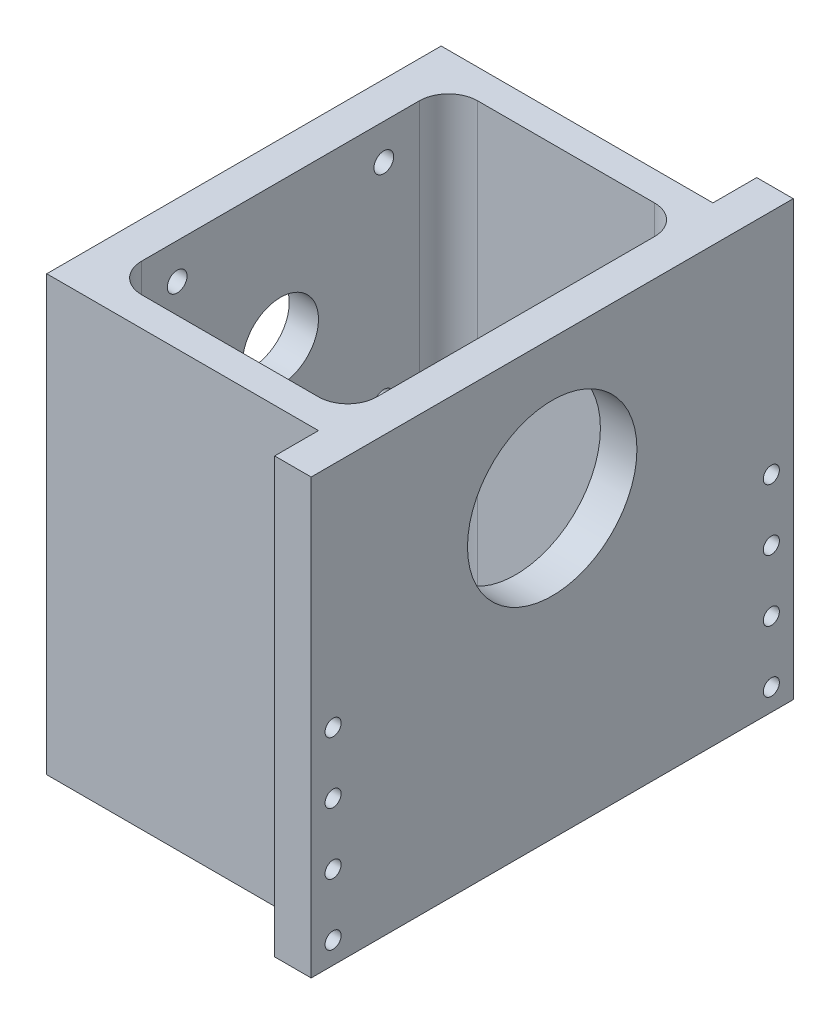
from build123d import *

# Parameters (mm, degrees)
EXTRUDE_1_DEPTH          = 297
SKETCH_6_R               = 57.15
CUT_EXTRUDE_1_DEPTH      = 5
CUT_EXTRUDE_2_REACH      = 528.789
SKETCH_7_R               = 26
CUT_EXTRUDE_3_REACH      = 530.764
SKETCH_8_R               = 58
CUT_EXTRUDE_4_REACH      = 521.294
SKETCH_10_R              = 5.5
HOLE_WIZARD_M12_1_D      = 13.5
HOLE_WIZARD_M12_1_DEPTH  = 25
PATTERN_CIRCULAR_1_COUNT = 4


with BuildPart() as part:
    # 草图4 → 凸台-拉伸1 (new body)
    with BuildSketch(Plane(origin=(0, 0, 0), x_dir=(1, 0, 0), z_dir=(0, 1, 0))):
        Polygon((-258.320541352, -83.224920734), (-258.320541352, -53.224920734), (-233.320541352, -53.224920734), (-233.320541352, -383.224920734), (-258.320541352, -383.224920734), (-258.320541352, -353.224920734), (-444.320541352, -353.224920734), (-444.320541352, -83.224920734), align=None)
        with BuildLine():
            Line((-258.320541352, -313.224920734), (-258.320541352, -123.224920734))
            ThreePointArc((-258.320541352, -123.224920734), (-264.178405729, -109.08278511), (-278.320541352, -103.224920734))
            Line((-278.320541352, -103.224920734), (-399.320541352, -103.224920734))
            ThreePointArc((-399.320541352, -103.224920734), (-413.462676976, -109.08278511), (-419.320541352, -123.224920734))
            Line((-419.320541352, -123.224920734), (-419.320541352, -313.224920734))
            ThreePointArc((-419.320541352, -313.224920734), (-413.462676976, -327.367056358), (-399.320541352, -333.224920734))
            Line((-399.320541352, -333.224920734), (-278.320541352, -333.224920734))
            ThreePointArc((-278.320541352, -333.224920734), (-264.178405729, -327.367056358), (-258.320541352, -313.224920734))
        make_face(mode=Mode.SUBTRACT)
    extrude(amount=EXTRUDE_1_DEPTH)

    # 草图6 → 切除-拉伸1 (cut)
    with BuildSketch(Plane.ZY.offset(444.320541352)):
        with Locations((218.224920734, 202)):
            Circle(SKETCH_6_R)
    extrude(amount=-CUT_EXTRUDE_1_DEPTH, mode=Mode.SUBTRACT)

    # 草图7 → 切除-拉伸2 (cut, up to next)
    with BuildSketch(Plane.ZY.offset(439.320541352), mode=Mode.PRIVATE) as cut_extrude_2_sk1:
        with Locations((218.224920734, 202)):
            Circle(SKETCH_7_R)
    cut_extrude_2_tool1 = extrude(cut_extrude_2_sk1.sketch, amount=-CUT_EXTRUDE_2_REACH, mode=Mode.PRIVATE) & part.part
    add(cut_extrude_2_tool1.solids().sort_by_distance((-439.320541, 202, 218.224921))[0], mode=Mode.SUBTRACT)

    # 草图8 → 切除-拉伸3 (cut, up to next)
    with BuildSketch(Plane(origin=(-233.320541352, 0, 0), x_dir=(0, 0, -1), z_dir=(1, 0, 0)), mode=Mode.PRIVATE) as cut_extrude_3_sk1:
        with Locations((-218.224920734, 202)):
            Circle(SKETCH_8_R)
    cut_extrude_3_tool1 = extrude(cut_extrude_3_sk1.sketch, amount=-CUT_EXTRUDE_3_REACH, mode=Mode.PRIVATE) & part.part
    add(cut_extrude_3_tool1.solids().sort_by_distance((-233.320541, 202, 218.224921))[0], mode=Mode.SUBTRACT)

    # 草图10 → 切除-拉伸4 (cut, up to next)
    with BuildSketch(Plane.ZY.offset(258.320541352), mode=Mode.PRIVATE) as cut_extrude_4_sk1:
        with Locations((368.224920734, 15)):
            Circle(SKETCH_10_R)
    cut_extrude_4_tool1 = extrude(cut_extrude_4_sk1.sketch, amount=-CUT_EXTRUDE_4_REACH, mode=Mode.PRIVATE) & part.part
    # 草图10 → 切除-拉伸4 (cut, up to next)
    with BuildSketch(Plane.ZY.offset(258.320541352), mode=Mode.PRIVATE) as cut_extrude_4_sk2:
        with Locations((368.224920734, 57)):
            Circle(SKETCH_10_R)
    cut_extrude_4_tool2 = extrude(cut_extrude_4_sk2.sketch, amount=-CUT_EXTRUDE_4_REACH, mode=Mode.PRIVATE) & part.part
    # 草图10 → 切除-拉伸4 (cut, up to next)
    with BuildSketch(Plane.ZY.offset(258.320541352), mode=Mode.PRIVATE) as cut_extrude_4_sk3:
        with Locations((368.224920734, 99)):
            Circle(SKETCH_10_R)
    cut_extrude_4_tool3 = extrude(cut_extrude_4_sk3.sketch, amount=-CUT_EXTRUDE_4_REACH, mode=Mode.PRIVATE) & part.part
    # 草图10 → 切除-拉伸4 (cut, up to next)
    with BuildSketch(Plane.ZY.offset(258.320541352), mode=Mode.PRIVATE) as cut_extrude_4_sk4:
        with Locations((368.224920734, 141)):
            Circle(SKETCH_10_R)
    cut_extrude_4_tool4 = extrude(cut_extrude_4_sk4.sketch, amount=-CUT_EXTRUDE_4_REACH, mode=Mode.PRIVATE) & part.part
    # 草图10 → 切除-拉伸4 (cut, up to next)
    with BuildSketch(Plane.ZY.offset(258.320541352), mode=Mode.PRIVATE) as cut_extrude_4_sk5:
        with Locations((68.224920734, 141)):
            Circle(SKETCH_10_R)
    cut_extrude_4_tool5 = extrude(cut_extrude_4_sk5.sketch, amount=-CUT_EXTRUDE_4_REACH, mode=Mode.PRIVATE) & part.part
    # 草图10 → 切除-拉伸4 (cut, up to next)
    with BuildSketch(Plane.ZY.offset(258.320541352), mode=Mode.PRIVATE) as cut_extrude_4_sk6:
        with Locations((68.224920734, 15)):
            Circle(SKETCH_10_R)
    cut_extrude_4_tool6 = extrude(cut_extrude_4_sk6.sketch, amount=-CUT_EXTRUDE_4_REACH, mode=Mode.PRIVATE) & part.part
    # 草图10 → 切除-拉伸4 (cut, up to next)
    with BuildSketch(Plane.ZY.offset(258.320541352), mode=Mode.PRIVATE) as cut_extrude_4_sk7:
        with Locations((68.224920734, 57)):
            Circle(SKETCH_10_R)
    cut_extrude_4_tool7 = extrude(cut_extrude_4_sk7.sketch, amount=-CUT_EXTRUDE_4_REACH, mode=Mode.PRIVATE) & part.part
    # 草图10 → 切除-拉伸4 (cut, up to next)
    with BuildSketch(Plane.ZY.offset(258.320541352), mode=Mode.PRIVATE) as cut_extrude_4_sk8:
        with Locations((68.224920734, 99)):
            Circle(SKETCH_10_R)
    cut_extrude_4_tool8 = extrude(cut_extrude_4_sk8.sketch, amount=-CUT_EXTRUDE_4_REACH, mode=Mode.PRIVATE) & part.part
    add(cut_extrude_4_tool1.solids().sort_by_distance((-258.320541, 15, 368.224921))[0], mode=Mode.SUBTRACT)
    add(cut_extrude_4_tool2.solids().sort_by_distance((-258.320541, 57, 368.224921))[0], mode=Mode.SUBTRACT)
    add(cut_extrude_4_tool3.solids().sort_by_distance((-258.320541, 99, 368.224921))[0], mode=Mode.SUBTRACT)
    add(cut_extrude_4_tool4.solids().sort_by_distance((-258.320541, 141, 368.224921))[0], mode=Mode.SUBTRACT)
    add(cut_extrude_4_tool5.solids().sort_by_distance((-258.320541, 141, 68.224921))[0], mode=Mode.SUBTRACT)
    add(cut_extrude_4_tool6.solids().sort_by_distance((-258.320541, 15, 68.224921))[0], mode=Mode.SUBTRACT)
    add(cut_extrude_4_tool7.solids().sort_by_distance((-258.320541, 57, 68.224921))[0], mode=Mode.SUBTRACT)
    add(cut_extrude_4_tool8.solids().sort_by_distance((-258.320541, 99, 68.224921))[0], mode=Mode.SUBTRACT)

    # M12 间隙孔1
    with Locations(Plane.ZY.offset(444.320541352)):
        with Locations((147.514920734, 272.711356231)):
            hole_wizard_m12_1 = Hole(HOLE_WIZARD_M12_1_D / 2, depth=HOLE_WIZARD_M12_1_DEPTH)

    # 阵列(圆周)1: M12 间隙孔1 ×4 about axis
    pattern_circular_1_axis = Axis((0, 202, 218.224920734), (1, 0, 0))
    for i in range(1, PATTERN_CIRCULAR_1_COUNT):
        add(hole_wizard_m12_1.rotate(pattern_circular_1_axis, i * 360 / PATTERN_CIRCULAR_1_COUNT), mode=Mode.SUBTRACT)


solid = part.part
